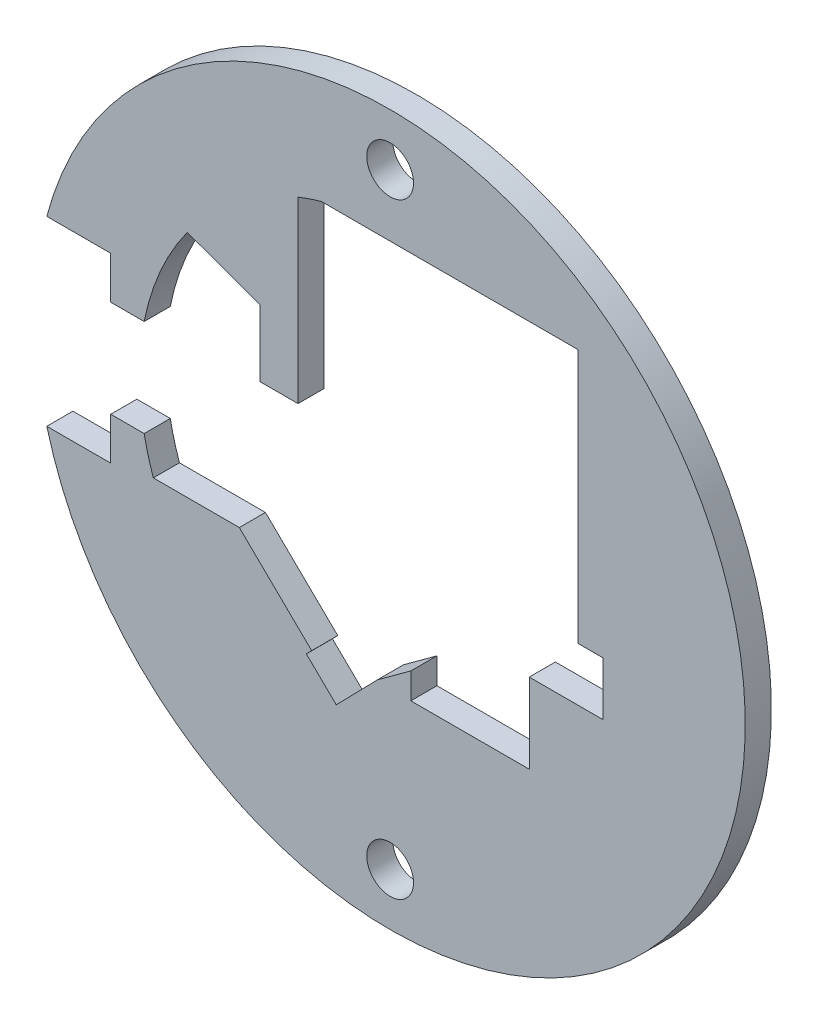
from build123d import *

# Parameters (mm, degrees)
SKETCH1_R           = 1.4224
BOSS_EXTRUDE1_DEPTH = 1.5875


with BuildPart() as part:
    # Sketch1 → Boss-Extrude1 (new body)
    with BuildSketch(Plane.XY):
        with BuildLine():
            Line((-14.952058744, -2.948480848), (-16.984058744, -2.948480848))
            Line((-16.984058744, -2.948480848), (-16.984058744, -5.5245))
            Line((-16.984058744, -5.5245), (-20.871224203, -5.5245))
            ThreePointArc((-20.871224203, -5.5245), (21.59, 0), (-20.871224203, 5.5245))
            Line((-20.871224203, 5.5245), (-16.984058744, 5.5245))
            Line((-16.984058744, 5.5245), (-16.984058744, 2.948480848))
            Line((-16.984058744, 2.948480848), (-14.952058744, 2.948480848))
            ThreePointArc((-14.952058744, 2.948480848), (-13.968818521, 6.093415226), (-12.332576282, 8.9535))
            Line((-12.332576282, 8.9535), (-7.9248, 7.366))
            Line((-7.9248, 7.366), (-7.9248, 3.302))
            Line((-7.9248, 3.302), (-5.6007, 3.302))
            Line((-5.6007, 3.302), (-5.6007, 14.173558463))
            ThreePointArc((-5.6007, 14.173558463), (-4.895856129, 14.43219293), (-4.179129857, 14.6558))
            Line((-4.179129857, 14.6558), (4.179129857, 14.6558))
            Line((4.179129857, 14.6558), (11.43, 14.6558))
            Line((11.43, 14.6558), (11.43, -0.8128))
            Line((11.43, -0.8128), (12.9413, -0.8128))
            Line((12.9413, -0.8128), (12.9413, -4.064))
            Line((12.9413, -4.064), (8.4582, -4.064))
            Line((8.4582, -4.064), (8.4582, -8.9154))
            Line((8.4582, -8.9154), (1.2573, -8.9154))
            Line((1.2573, -8.9154), (1.2573, -7.3406))
            Line((1.2573, -7.3406), (-0.7747, -8.8265))
            Line((-0.7747, -8.8265), (-3.273729572, -11.3919))
            Line((-3.273729572, -11.3919), (-5.093162196, -9.619538602))
            Line((-5.093162196, -9.619538602), (-4.769706241, -9.287492148))
            Line((-4.769706241, -9.287492148), (-9.167166743, -5.0038))
            Line((-9.167166743, -5.0038), (-14.395123673, -5.0038))
            ThreePointArc((-14.395123673, -5.0038), (-14.709533071, -3.985879682), (-14.952058744, -2.948480848))
        make_face()
        with Locations((0, 18.415)):
            Circle(SKETCH1_R, mode=Mode.SUBTRACT)
        with Locations((0, -18.415)):
            Circle(SKETCH1_R, mode=Mode.SUBTRACT)
    extrude(amount=BOSS_EXTRUDE1_DEPTH)


solid = part.part
